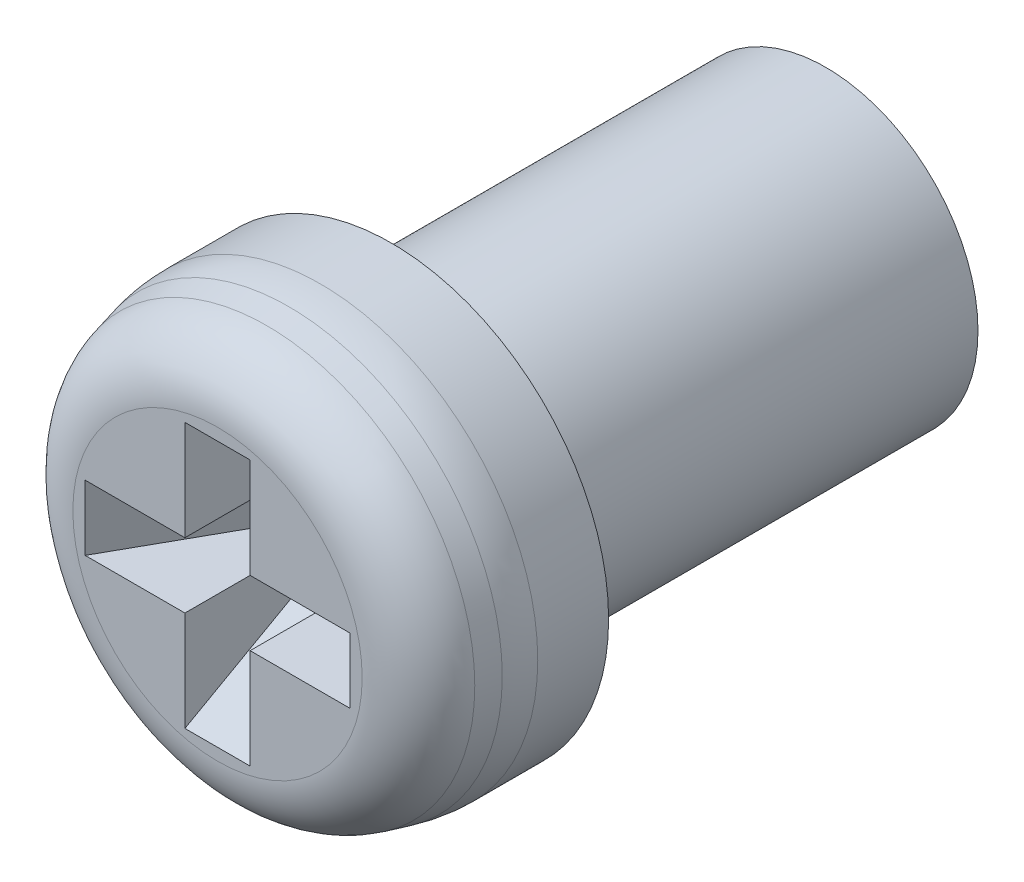
from build123d import *

# Parameters (mm, degrees)
SZKIC1_R                        = 3.5
DODANIE_WYCI_GNI_CIE1_DEPTH     = 10
SZKIC3_R                        = 5
DODANIE_WYCI_GNI_CIE2_DEPTH     = 4
SFAZOWANIE2_SIZE                = 2
SFAZOWANIE2_SIZE2               = 0.5
ZAOKR_GLENIE1_R                 = 1.5
ZAOKR_GLENIE2_R                 = 3
ZAOKR_GLENIE3_R                 = 0.5
WYTNIJ_WYCI_GNI_CIE1_DEPTH      = 0.75
WYTNIJ_WYCI_GNI_CIE1_DEPTH_BACK = 0.75
WYTNIJ_WYCI_GNI_CIE2_DEPTH      = 0.75
WYTNIJ_WYCI_GNI_CIE2_DEPTH_BACK = 0.75


with BuildPart() as part:
    # Szkic1 → Dodanie-wyciągnięcie1 (new body)
    with BuildSketch(Plane.XY):
        Circle(SZKIC1_R)
    extrude(amount=DODANIE_WYCI_GNI_CIE1_DEPTH)

    # Szkic3 → Dodanie-wyciągnięcie2 (add)
    with BuildSketch(Plane.XY.offset(10)):
        Circle(SZKIC3_R)
    extrude(amount=DODANIE_WYCI_GNI_CIE2_DEPTH)

    # Sfazowanie2
    sfazowanie2_edges = [part.edges().sort_by_distance(p)[0] for p in [
        (-5, 0, 14),
    ]]
    sfazowanie2_side = [part.faces().sort_by_distance(p)[0] for p in [
        (-5, 0, 12),
    ]]
    chamfer(sfazowanie2_edges, length=SFAZOWANIE2_SIZE, length2=SFAZOWANIE2_SIZE2, reference=sfazowanie2_side[0])

    # Zaokrąglenie1
    zaokr_glenie1_edges = [part.edges().sort_by_distance(p)[0] for p in [
        (-4.5, 0, 14),
    ]]
    fillet(zaokr_glenie1_edges, radius=ZAOKR_GLENIE1_R)

    # Zaokrąglenie2
    zaokr_glenie2_edges = [part.edges().sort_by_distance(p)[0] for p in [
        (-5, 0, 12),
    ]]
    fillet(zaokr_glenie2_edges, radius=ZAOKR_GLENIE2_R)

    # Zaokrąglenie3
    zaokr_glenie3_edges = [part.edges().sort_by_distance(p)[0] for p in [
        (-3.5, 0, 10),
    ]]
    fillet(zaokr_glenie3_edges, radius=ZAOKR_GLENIE3_R)

    # Szkic4 → Wytnij-wyciągnięcie1 (cut, two sides: drawn at the far end of the back side and taken through both)
    with BuildSketch(Plane(origin=(0, 0, 0), x_dir=(1, 0, 0), z_dir=(0, 1, 0)).offset(-WYTNIJ_WYCI_GNI_CIE1_DEPTH_BACK)):
        Polygon((3.045898371, -14), (-3.045898371, -14), (-0.25, -9), (0, -9), (0.25, -9), align=None)
    extrude(amount=WYTNIJ_WYCI_GNI_CIE1_DEPTH + WYTNIJ_WYCI_GNI_CIE1_DEPTH_BACK, mode=Mode.SUBTRACT)

    # Szkic5 → Wytnij-wyciągnięcie2 (cut, two sides: drawn at the far end of the back side and taken through both)
    with BuildSketch(Plane(origin=(0, 0, 0), x_dir=(0, 0, -1), z_dir=(1, 0, 0)).offset(-WYTNIJ_WYCI_GNI_CIE2_DEPTH_BACK)):
        Polygon((-9, 0), (-9, 0.25), (-14, 3.05), (-14, -3.05), (-9, -0.25), align=None)
    extrude(amount=WYTNIJ_WYCI_GNI_CIE2_DEPTH + WYTNIJ_WYCI_GNI_CIE2_DEPTH_BACK, mode=Mode.SUBTRACT)


solid = part.part
